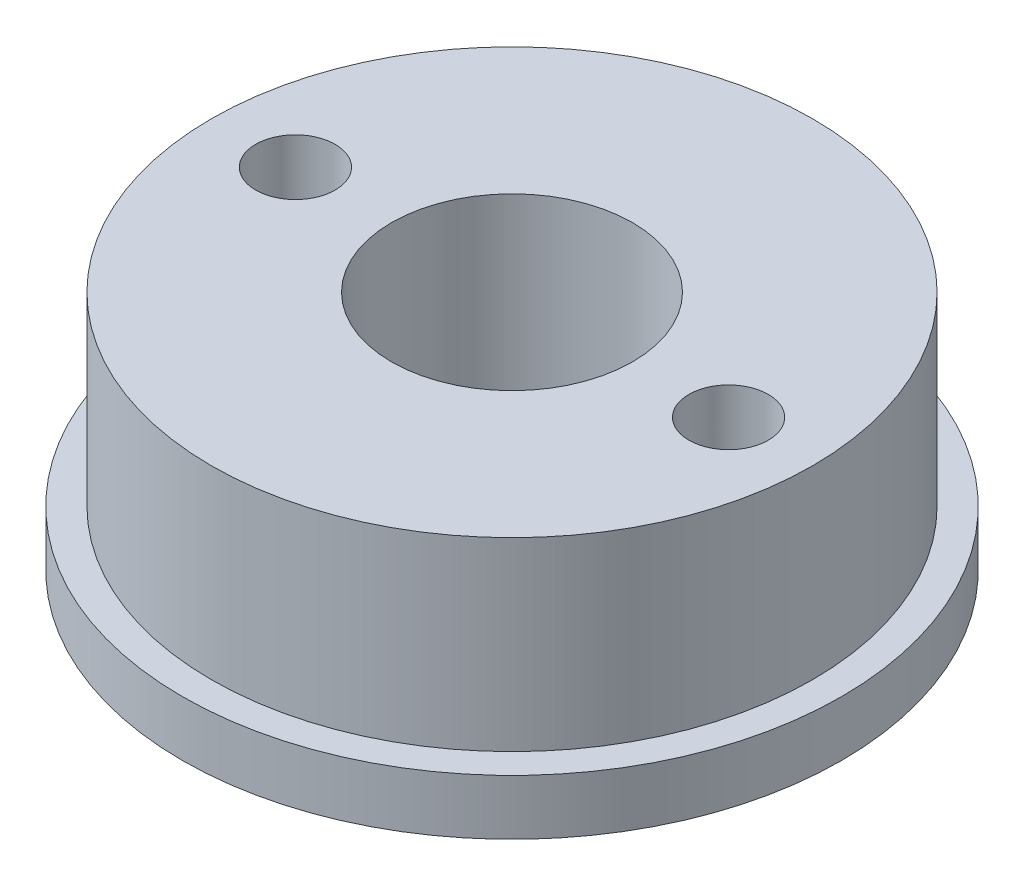
from build123d import *

# Parameters (mm, degrees)
SKETCH_1_R          = 13.7
EXTRUDE_1_DEPTH     = 2.3
SKETCH_2_R          = 12.49
EXTRUDE_2_DEPTH     = 7.7
SKETCH_3_R          = 5.01
SKETCH_3_R_2        = 1.65
CUT_EXTRUDE_1_DEPTH = 10


with BuildPart() as part:
    # ｽｹｯﾁ1 → ﾎﾞｽ - 押し出し1 (new body)
    with BuildSketch(Plane(origin=(0, 0, 0), x_dir=(1, 0, 0), z_dir=(0, 1, 0))):
        with Locations(Location((0, 0, 0), (0, 0, 270))):
            Circle(SKETCH_1_R)
    extrude(amount=EXTRUDE_1_DEPTH)

    # ｽｹｯﾁ2 → ﾎﾞｽ - 押し出し2 (add)
    with BuildSketch(Plane(origin=(0, 2.3, 0), x_dir=(1, 0, 0), z_dir=(0, 1, 0))):
        with Locations(Location((0, 0, 0), (0, 0, 270))):
            Circle(SKETCH_2_R)
    extrude(amount=EXTRUDE_2_DEPTH)

    # ｽｹｯﾁ3 → ｶｯﾄ - 押し出し1 (cut)
    with BuildSketch(Plane.XZ):
        with Locations(Location((0, 0, 0), (0, 0, 270))):
            Circle(SKETCH_3_R)
        with Locations(Location((9, 0, 0), (0, 0, 270))):
            Circle(SKETCH_3_R_2)
        with Locations(Location((-9, 0, 0), (0, 0, 90))):
            Circle(SKETCH_3_R_2)
    extrude(amount=-CUT_EXTRUDE_1_DEPTH, mode=Mode.SUBTRACT)


solid = part.part
